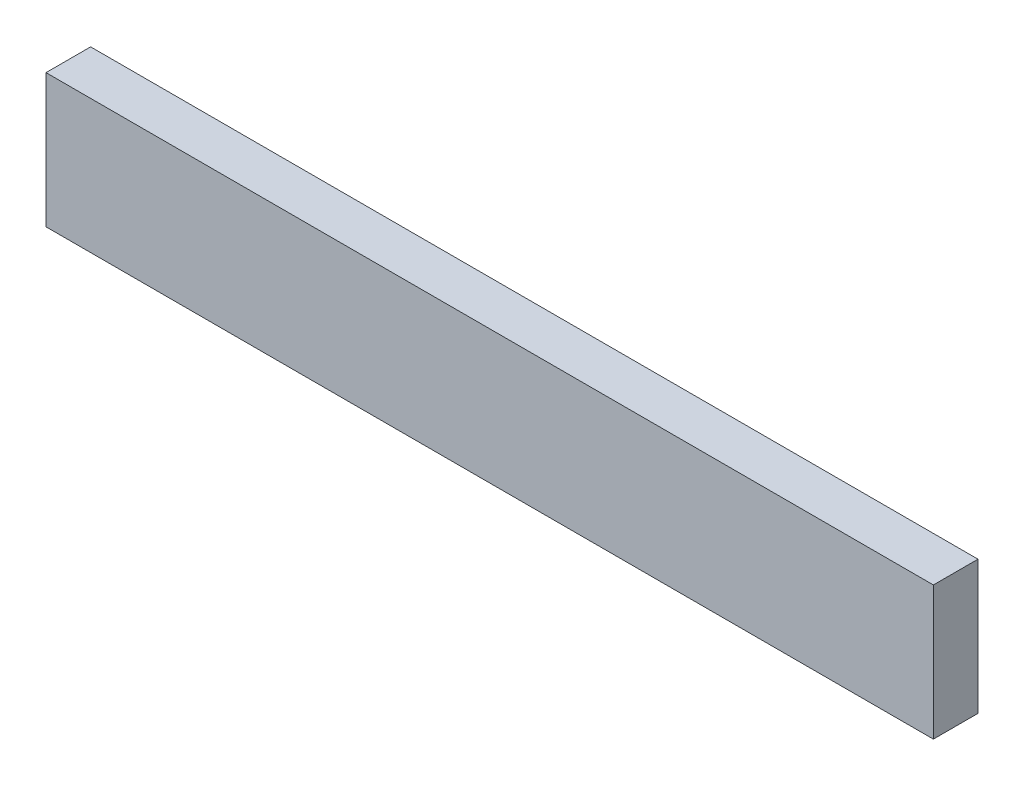
from build123d import *

# Parameters (mm, degrees)
SKETCH1_W           = 278.4
SKETCH1_H           = 41.9
BOSS_EXTRUDE1_DEPTH = 14


with BuildPart() as part:
    # Sketch1 → Boss-Extrude1 (new body)
    with BuildSketch(Plane.XY):
        Rectangle(SKETCH1_W, SKETCH1_H)
    extrude(amount=BOSS_EXTRUDE1_DEPTH)


solid = part.part
